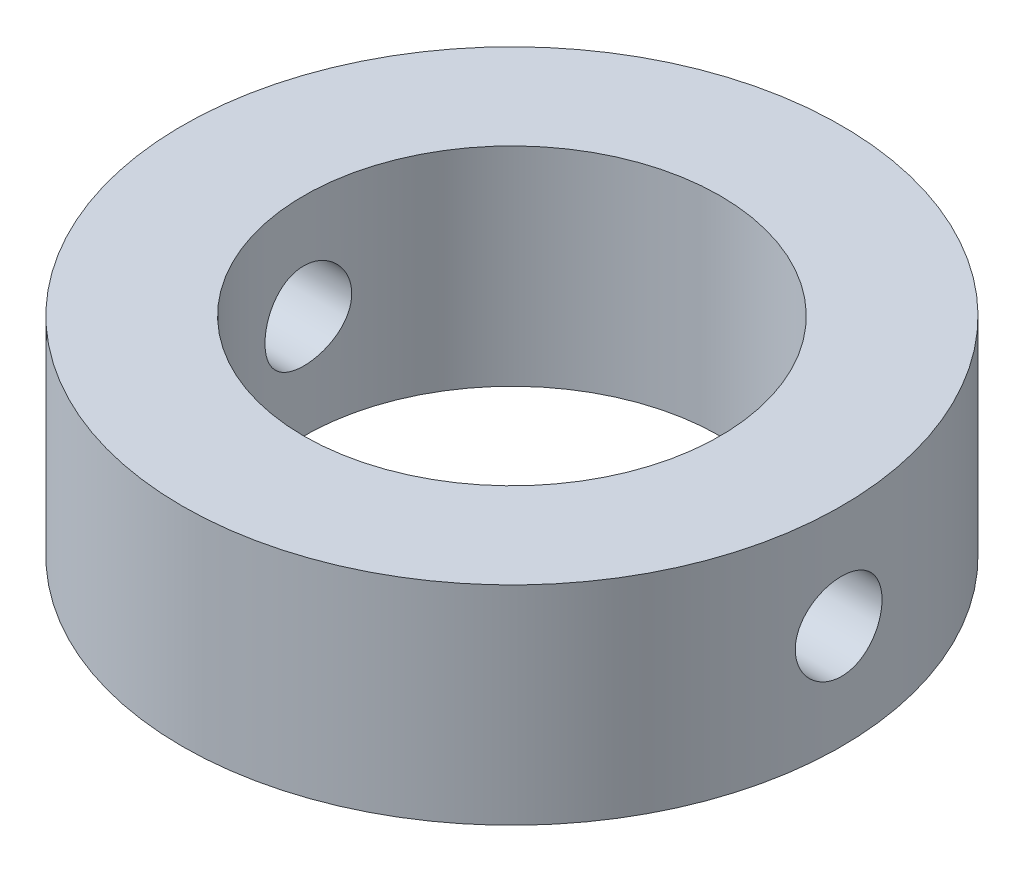
from build123d import *

# Parameters (mm, degrees)
SKETCH1_R               = 19
SKETCH1_R_2             = 12
BOSS_EXTRUDE1_DEPTH     = 12
CUT_EXTRUDE1_DEPTH      = 30.427877939
CUT_EXTRUDE1_DEPTH_BACK = 30.427877939
SKETCH5_R               = 2.5


with BuildPart() as part:
    # Sketch1 → Boss-Extrude1 (new body)
    with BuildSketch(Plane(origin=(0, 0, 0), x_dir=(1, 0, 0), z_dir=(0, 1, 0))):
        with Locations(Location((0, 0, 0), (0, 0, 270))):
            Circle(SKETCH1_R)
        with Locations(Location((0, 0, 0), (0, 0, 270))):
            Circle(SKETCH1_R_2, mode=Mode.SUBTRACT)
    extrude(amount=BOSS_EXTRUDE1_DEPTH)

    # Sketch5 → Cut-Extrude1 (cut, two sides: drawn at the far end of the back side and taken through both)
    with BuildSketch(Plane(origin=(0, 0, 0), x_dir=(0, 0, -1), z_dir=(1, 0, 0)).offset(-CUT_EXTRUDE1_DEPTH_BACK)):
        with Locations((0, 6)):
            Circle(SKETCH5_R)
    extrude(amount=CUT_EXTRUDE1_DEPTH + CUT_EXTRUDE1_DEPTH_BACK, mode=Mode.SUBTRACT)


solid = part.part
